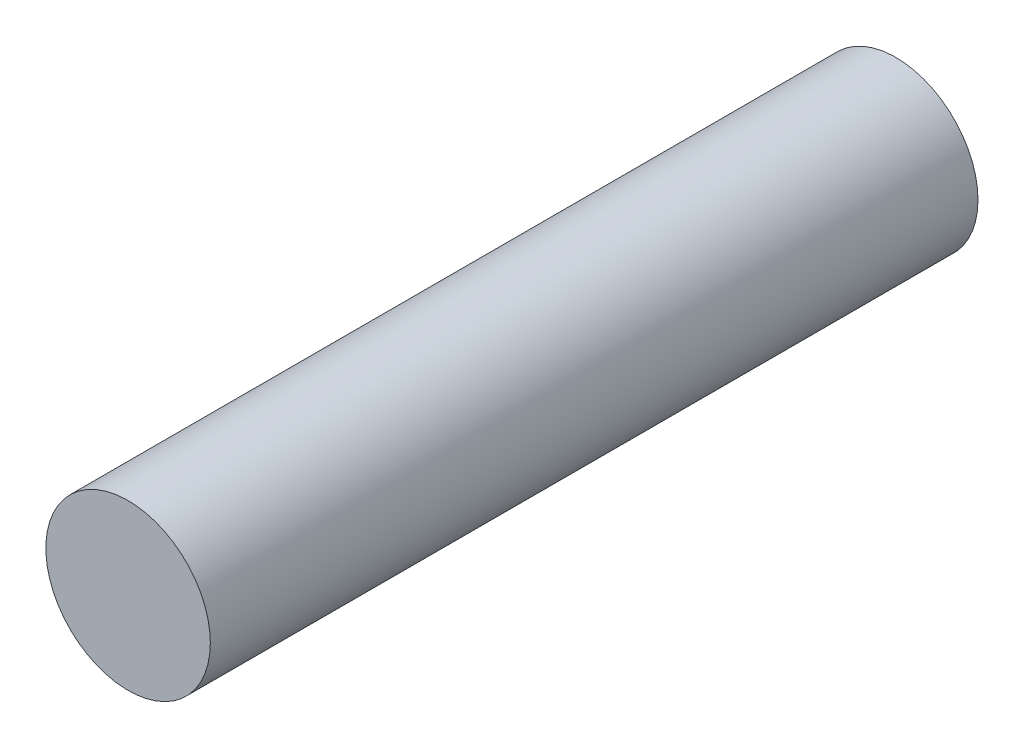
from build123d import *

# Parameters (mm, degrees)
SKETCH_1_R      = 3
EXTRUDE_1_DEPTH = 28


with BuildPart() as part:
    # 草图1 → 凸台-拉伸1 (new body)
    with BuildSketch(Plane.XY):
        Circle(SKETCH_1_R)
    extrude(amount=EXTRUDE_1_DEPTH)


solid = part.part
